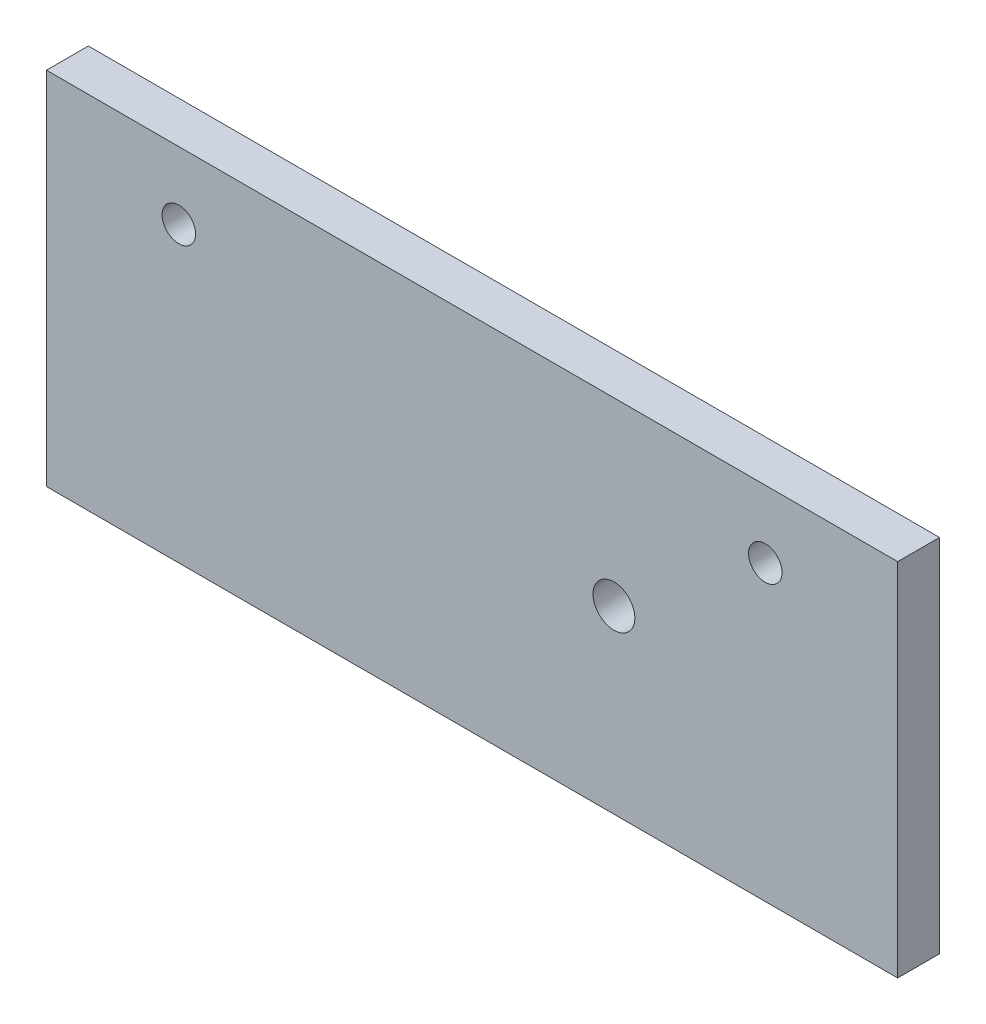
from build123d import *

# Parameters (mm, degrees)
SKETCH1_W           = 101.6
SKETCH1_H           = 43.04
BOSS_EXTRUDE1_DEPTH = 5
SKETCH2_R           = 2.5
CUT_EXTRUDE1_DEPTH  = 56.396303126
SKETCH3_R           = 2
CUT_EXTRUDE2_DEPTH  = 56.396303126


with BuildPart() as part:
    # Sketch1 → Boss-Extrude1 (new body)
    with BuildSketch(Plane.XY):
        Rectangle(SKETCH1_W, SKETCH1_H)
    extrude(amount=BOSS_EXTRUDE1_DEPTH)

    # Sketch2 → Cut-Extrude1 (cut, through all)
    with BuildSketch(Plane.XY.offset(5)):
        with Locations((16.93333334, 0)):
            Circle(SKETCH2_R)
    extrude(amount=-CUT_EXTRUDE1_DEPTH, mode=Mode.SUBTRACT)

    # Sketch3 → Cut-Extrude2 (cut, through all)
    with BuildSketch(Plane.XY.offset(5)):
        with Locations((-35, 13.48)):
            Circle(SKETCH3_R)
        with Locations((35, 13.48)):
            Circle(SKETCH3_R)
    extrude(amount=-CUT_EXTRUDE2_DEPTH, mode=Mode.SUBTRACT)


solid = part.part
